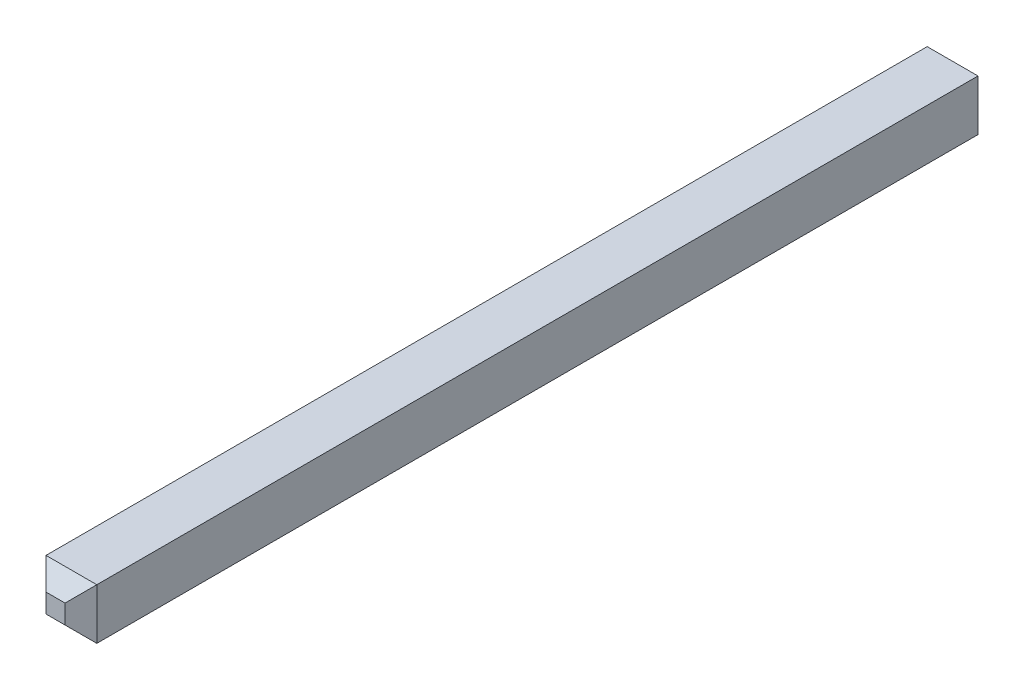
from build123d import *

# Parameters (mm, degrees)
EXTRUDE_1_DEPTH      = 8
EXTRUDE_1_DEPTH_BACK = 3.5
SKETCH_1_W           = 0.64
SKETCH_1_H           = 0.64
CHAMFER_1_SIZE       = 0.2


with BuildPart() as part:
    # Эскиз1 → Бобышка-Вытянуть1 (new, two sides: drawn at the far end of the back side and taken through both)
    with BuildSketch(Plane.XY.offset(-EXTRUDE_1_DEPTH_BACK)):
        Rectangle(SKETCH_1_W, SKETCH_1_H)
    extrude(amount=EXTRUDE_1_DEPTH + EXTRUDE_1_DEPTH_BACK)

    # Фаска1
    chamfer_1_edges = [part.edges().sort_by_distance(p)[0] for p in [
        (0.32, 0, 8),
        (-0.32, 0, -3.5),
        (0, 0.32, 8),
        (-0.32, 0, 8),
        (0, -0.32, 8),
        (0, -0.32, -3.5),
        (0.32, 0, -3.5),
        (0, 0.32, -3.5),
    ]]
    chamfer(chamfer_1_edges, length=CHAMFER_1_SIZE)


solid = part.part
